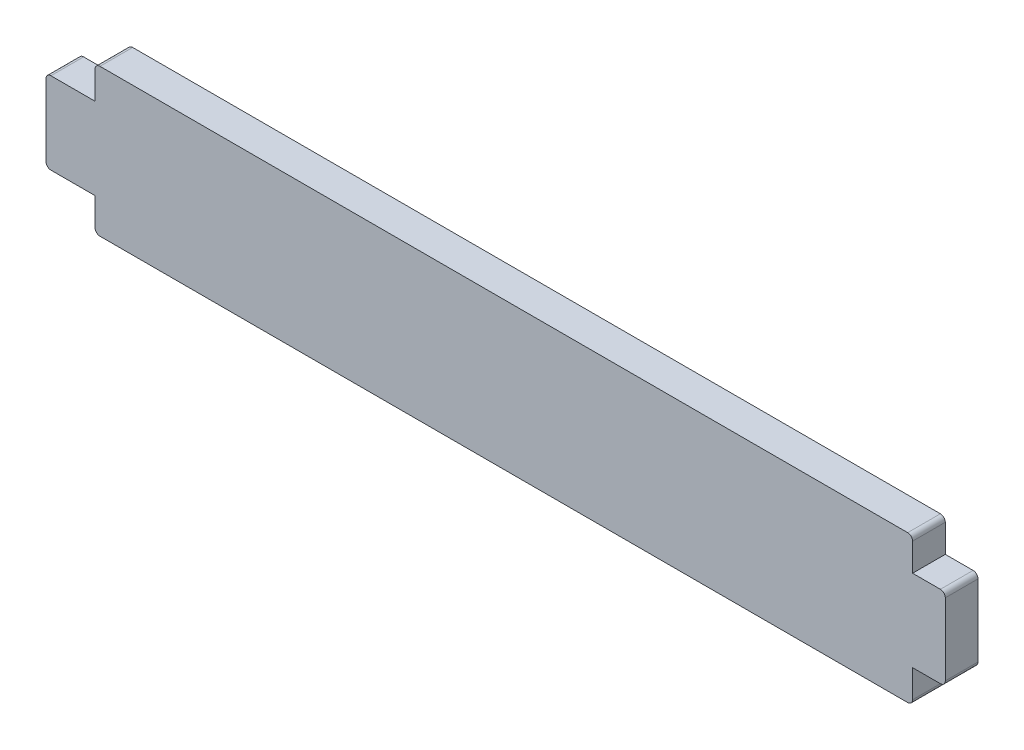
from build123d import *

# Parameters (mm, degrees)
BOSS_EXTRUDE1_DEPTH = 2
FILLET5_R           = 0.3
FILLET7_R           = 0.3
FILLET8_R           = 0.3
FILLET9_R           = 0.3
FILLET10_R          = 0.3
FILLET11_R          = 0.3


with BuildPart() as part:
    # Sketch1 → Boss-Extrude1 (new body)
    with BuildSketch(Plane.XY):
        Polygon((-24.5, -2.5), (-24.5, -4.5), (25.5, -4.5), (25.5, -2.5), (27.5, -2.5), (27.5, 2.5), (25.5, 2.5), (25.5, 4.5), (-24.5, 4.5), (-24.5, 2.5), (-27.5, 2.5), (-27.5, -2.5), align=None)
    extrude(amount=BOSS_EXTRUDE1_DEPTH)

    # Fillet5
    fillet5_edges = [part.edges().sort_by_distance(p)[0] for p in [
        (-27.5, -2.5, 1),
    ]]
    fillet(fillet5_edges, radius=FILLET5_R)

    # Fillet7
    fillet7_edges = [part.edges().sort_by_distance(p)[0] for p in [
        (-24.5, -4.5, 1),
    ]]
    fillet(fillet7_edges, radius=FILLET7_R)

    # Fillet8
    fillet8_edges = [part.edges().sort_by_distance(p)[0] for p in [
        (-24.5, 4.5, 1),
    ]]
    fillet(fillet8_edges, radius=FILLET8_R)

    # Fillet9
    fillet9_edges = [part.edges().sort_by_distance(p)[0] for p in [
        (25.5, -4.5, 1),
    ]]
    fillet(fillet9_edges, radius=FILLET9_R)

    # Fillet10
    fillet10_edges = [part.edges().sort_by_distance(p)[0] for p in [
        (25.5, 4.5, 1),
        (27.5, 2.5, 1),
        (27.5, -2.5, 1),
    ]]
    fillet(fillet10_edges, radius=FILLET10_R)

    # Fillet11
    fillet11_edges = [part.edges().sort_by_distance(p)[0] for p in [
        (-27.5, 2.5, 1),
    ]]
    fillet(fillet11_edges, radius=FILLET11_R)


solid = part.part
